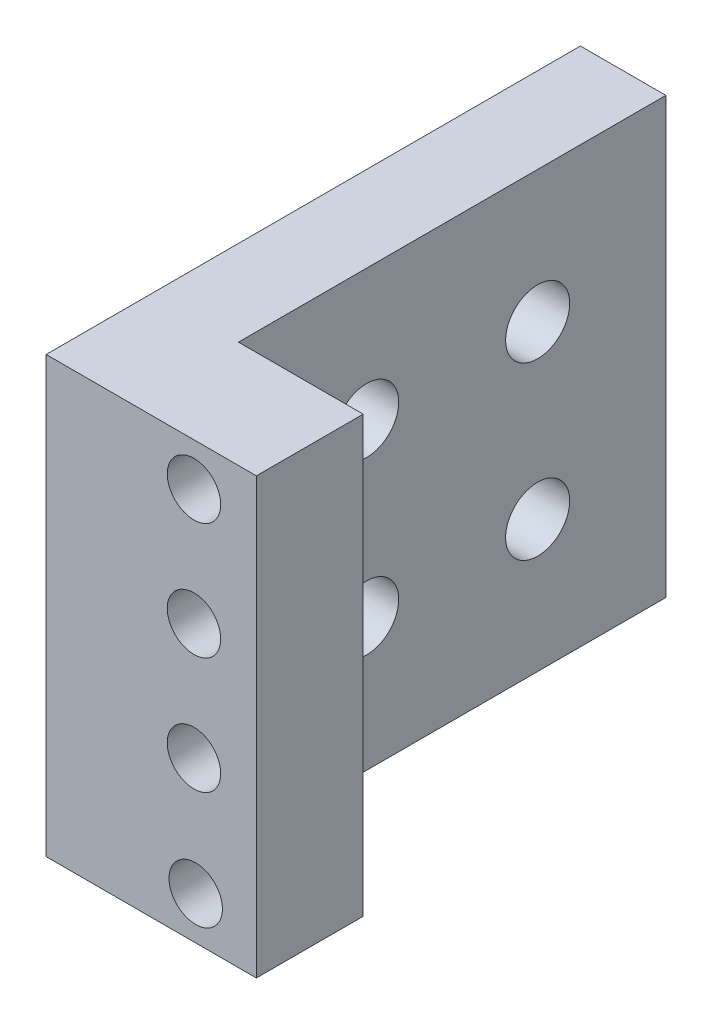
from build123d import *

# Parameters (mm, degrees)
SKETCH_1_R          = 1.25
EXTRUDE_1_DEPTH     = 5
SKETCH_2_W          = 5
SKETCH_2_H          = 20.349408335
EXTRUDE_2_DEPTH     = 4
SKETCH_3_W          = 4
SKETCH_3_H          = 20.349408335
EXTRUDE_3_DEPTH     = 20
SKETCH_4_R          = 1.5
CUT_EXTRUDE_1_DEPTH = 20


with BuildPart() as part:
    # 草图1 → 凸台-拉伸1 (new body)
    with BuildSketch(Plane.XY):
        Polygon((-3, -8.027992706), (-3, -12.611885422), (2.837697315, -12.611885422), (2.837697315, -6.641886627), (2.837697315, 7.737522913), (-3, 7.737522913), align=None)
        with Locations((-0.081151343, 5.737522913)):
            Circle(SKETCH_1_R, mode=Mode.SUBTRACT)
        with Locations((-0.081151343, 0.287522913)):
            Circle(SKETCH_1_R, mode=Mode.SUBTRACT)
        with Locations((-0.081151343, -5.162477087)):
            Circle(SKETCH_1_R, mode=Mode.SUBTRACT)
        with Locations((-0.000846901, -10.611885422)):
            Circle(SKETCH_1_R, mode=Mode.SUBTRACT)
    extrude(amount=EXTRUDE_1_DEPTH)

    # 草图2 → 凸台-拉伸2 (add)
    with BuildSketch(Plane.ZY.offset(3)):
        with Locations((2.5, -2.437181255)):
            Rectangle(SKETCH_2_W, SKETCH_2_H)
    extrude(amount=EXTRUDE_2_DEPTH)

    # 草图3 → 凸台-拉伸3 (add)
    with BuildSketch(Plane(origin=(0, 0, 0), x_dir=(-1, 0, 0), z_dir=(0, 0, -1))):
        with Locations((5, -2.437181255)):
            Rectangle(SKETCH_3_W, SKETCH_3_H)
    extrude(amount=EXTRUDE_3_DEPTH)

    # 草图4 → 切除-拉伸1 (cut)
    with BuildSketch(Plane(origin=(-3, 0, 0), x_dir=(0, 0, -1), z_dir=(1, 0, 0))):
        with Locations(Location((6, 1.562818745, 0), (0, 0, 90))):
            Circle(SKETCH_4_R)
        with Locations(Location((14, 1.562818745, 0), (0, 0, 180))):
            Circle(SKETCH_4_R)
        with Locations(Location((14, -6.437181255, 0), (0, 0, 90))):
            Circle(SKETCH_4_R)
        with Locations(Location((6, -6.437181255, 0), (0, 0, 180))):
            Circle(SKETCH_4_R)
    extrude(amount=-CUT_EXTRUDE_1_DEPTH, mode=Mode.SUBTRACT)


solid = part.part
